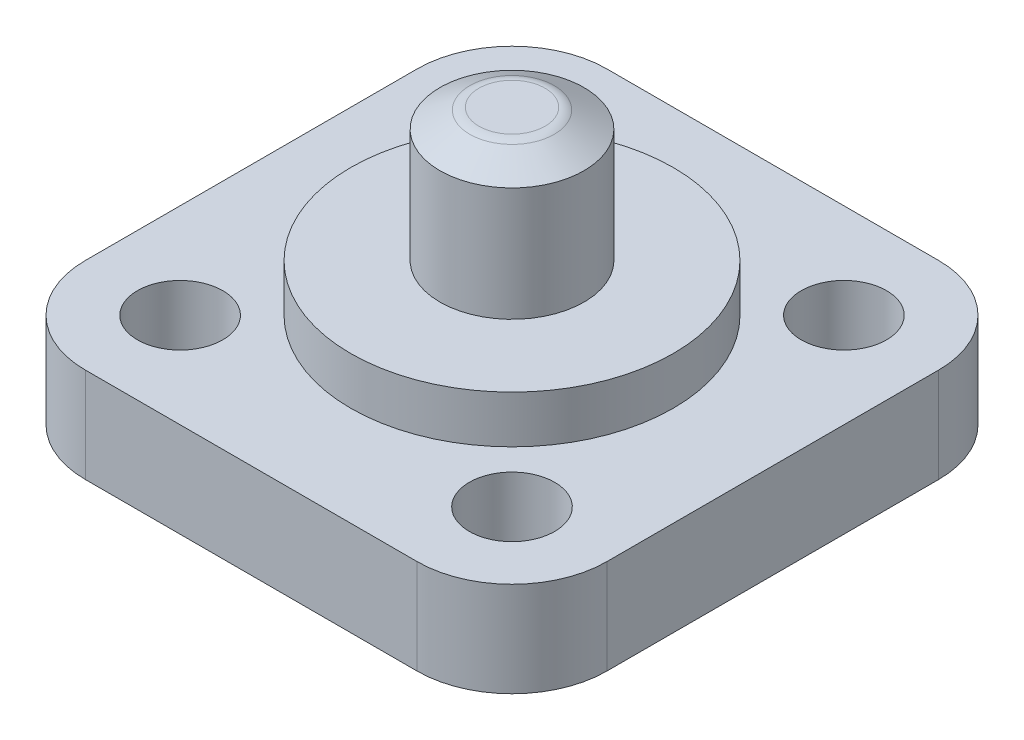
from build123d import *

# Parameters (mm, degrees)
BOSS_EXTRUDE1_DEPTH                        = 10
SKETCH3_R                                  = 4.5
CUT_EXTRUDE1_DEPTH                         = 44.28394626
MIRROR1_AT_THE_SECOND_PLANE_COPY_1_SKETC_R = 4.5
MIRROR1_AT_THE_SECOND_PLANE_COPY_1_DEPTH   = 44.28394626


with BuildPart() as part:
    # Sketch1 → Revolve1 (revolve)
    with BuildSketch(Plane.XY, mode=Mode.PRIVATE) as revolve1_sk:
        with BuildLine():
            Line((0, 9.5), (3.481747944, 9.5))
            ThreePointArc((3.481747944, 9.5), (3.98343056, 9.436056443), (4.453033806, 9.248314552))
            Line((4.453033806, 9.248314552), (7.6, 7.5))
            Line((7.6, 7.5), (7.6, -4.5))
            Line((7.6, -4.5), (17, -4.5))
            Line((17, -4.5), (17, -9.5))
            Line((17, -9.5), (7.6, -9.5))
            Line((7.6, -9.5), (0, -9.5))
            Line((0, -9.5), (0, 9.5))
        make_face()
    revolve(revolve1_sk.sketch.rotate(Axis((0, 9.5, 0), (0, -1, 0)), 90), axis=Axis((0, 9.5, 0), (0, -1, 0)))

    # Sketch2 → Boss-Extrude1 (add)
    with BuildSketch(Plane.XZ.offset(9.5)):
        with BuildLine():
            Line((17.5, 27.5), (-17.5, 27.5))
            ThreePointArc((-17.5, 27.5), (-24.571067812, 24.571067812), (-27.5, 17.5))
            Line((-27.5, 17.5), (-27.5, -17.5))
            ThreePointArc((-27.5, -17.5), (-24.571067812, -24.571067812), (-17.5, -27.5))
            Line((-17.5, -27.5), (17.5, -27.5))
            ThreePointArc((17.5, -27.5), (24.571067812, -24.571067812), (27.5, -17.5))
            Line((27.5, -17.5), (27.5, 17.5))
            ThreePointArc((27.5, 17.5), (24.571067812, 24.571067812), (17.5, 27.5))
        make_face()
    extrude(amount=BOSS_EXTRUDE1_DEPTH)

    # Sketch3 → Cut-Extrude1 (cut, through all)
    with BuildSketch(Plane(origin=(0, -9.5, 0), x_dir=(1, 0, 0), z_dir=(0, 1, 0))):
        with Locations(Location((-17.5, 17.5, 0), (0, 0, 270))):
            Circle(SKETCH3_R)
    cut_extrude1 = extrude(amount=-CUT_EXTRUDE1_DEPTH, mode=Mode.SUBTRACT)

    # Mirror1: Cut-Extrude1 across plane
    add(cut_extrude1.mirror(Plane.XY), mode=Mode.SUBTRACT)

    # Mirror1 at the second plane: Cut-Extrude1 across plane
    add(cut_extrude1.mirror(Plane(origin=(0, 0, 0), x_dir=(0, 0, 1), z_dir=(1, 0, 0))), mode=Mode.SUBTRACT)

    # Mirror1 at the second plane copy 1 sketc → Mirror1 at the second plane copy 1 (cut, through all)
    with BuildSketch(Plane(origin=(0, -9.5, 0), x_dir=(-1, 0, 0), z_dir=(0, 1, 0))):
        with Locations(Location((-17.5, 17.5, 0), (0, 0, 270))):
            Circle(MIRROR1_AT_THE_SECOND_PLANE_COPY_1_SKETC_R)
    extrude(amount=-MIRROR1_AT_THE_SECOND_PLANE_COPY_1_DEPTH, mode=Mode.SUBTRACT)


solid = part.part
